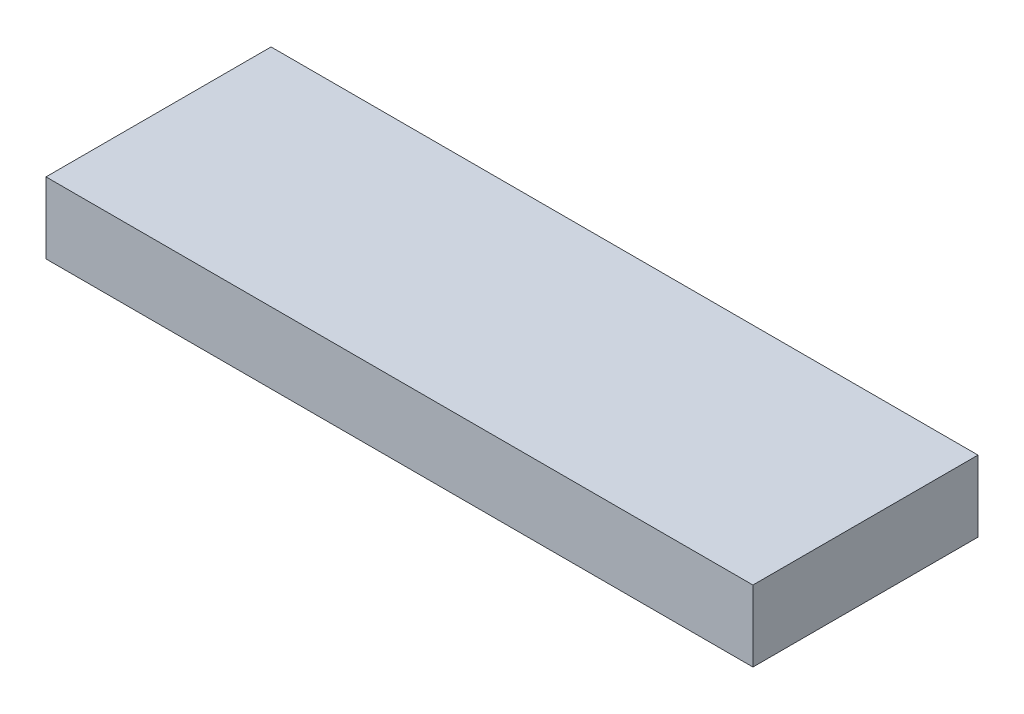
from build123d import *

# Parameters (mm, degrees)
SKETCH1_W           = 189.477532672
SKETCH1_H           = 19.05
BOSS_EXTRUDE1_DEPTH = 60.325
HOLE1_D             = 3.175
HOLE1_DEPTH         = 38.1
HOLE1_CSINK_D       = 10.16
HOLE1_CSINK_ANGLE   = 82
HOLE1_TIP           = 0.953866233


with BuildPart() as part:
    # Sketch1 → Boss-Extrude1 (new body)
    with BuildSketch(Plane.XY):
        with Locations((0, -273.05)):
            Rectangle(SKETCH1_W, SKETCH1_H)
    extrude(amount=BOSS_EXTRUDE1_DEPTH)

    # Hole1
    with Locations(Plane(origin=(0, 3.175, -25.4), x_dir=(-1, 0, 0), z_dir=(0, 0, -1))):
        with Locations((-75.688766336, -9.525), (218.563766336, -31.75), (218.563766336, -218.821), (218.563766336, -418.592), (104.263766336, -19.05), (104.263766336, -149.225), (104.263766336, -279.4), (120.138766336, -330.2), (120.138766336, -441.325), (-120.138766336, -441.325), (-120.138766336, -330.2), (-104.263766336, -279.4), (-104.263766336, -149.225), (-104.263766336, -19.05), (-218.563766336, -418.592), (-218.563766336, -218.821), (-218.563766336, -31.75), (0, -304.8), (107.438766336, -304.8), (-107.438766336, -304.8), (75.688766336, -276.225), (0, -276.225), (-75.688766336, -276.225), (75.688766336, -9.525), (0, -9.525)):
            CounterSinkHole(HOLE1_D / 2, HOLE1_CSINK_D / 2, depth=HOLE1_DEPTH, counter_sink_angle=HOLE1_CSINK_ANGLE)
            with Locations((0, 0, -(HOLE1_DEPTH + HOLE1_TIP / 2))):  # 118° drill point
                Cone(0, HOLE1_D / 2, HOLE1_TIP, mode=Mode.SUBTRACT)


solid = part.part
